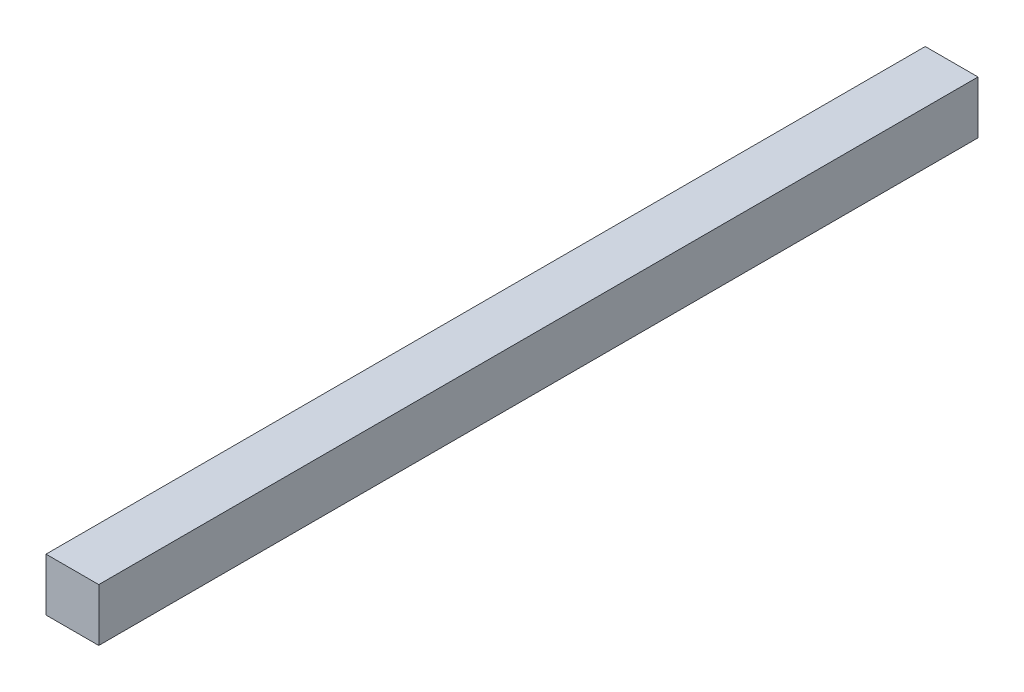
from build123d import *

# Parameters (mm, degrees)
SKETCH1_W           = 18
SKETCH1_H           = 18
BOSS_EXTRUDE1_DEPTH = 300


with BuildPart() as part:
    # Sketch1 → Boss-Extrude1 (new body)
    with BuildSketch(Plane.XY):
        with Locations((9, 0)):
            Rectangle(SKETCH1_W, SKETCH1_H)
    extrude(amount=BOSS_EXTRUDE1_DEPTH)


solid = part.part
